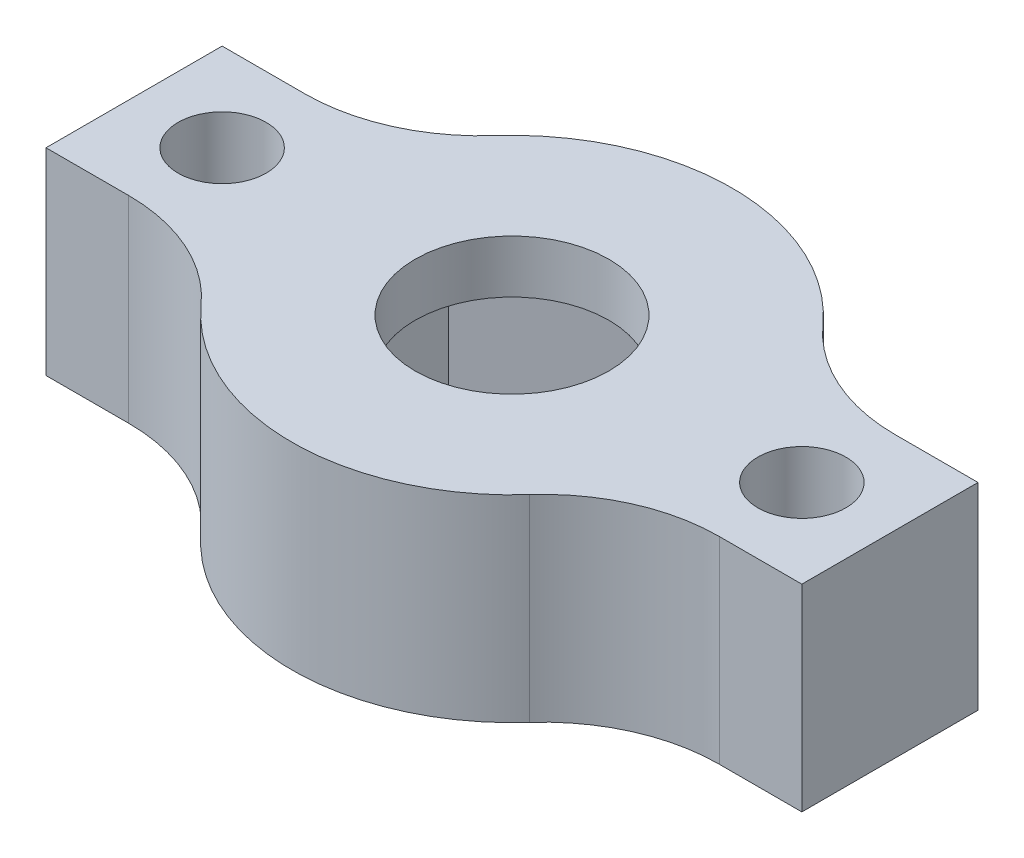
from build123d import *

# Parameters (mm, degrees)
SKETCH_1_R          = 12.5
EXTRUDE_1_DEPTH     = 8.2
SKETCH_2_R          = 12.5
EXTRUDE_2_DEPTH     = 3
SKETCH_3_W          = 10
SKETCH_3_H          = 10
EXTRUDE_3_DEPTH     = 11.2
FILLET_1_R          = 10
SKETCH_4_R          = 2.5
CUT_EXTRUDE_4_DEPTH = 28.240939498
SKETCH_5_R          = 5.5
CUT_EXTRUDE_5_DEPTH = 4


with BuildPart() as part:
    # Эскиз1 → Вытянуть1 (new body)
    with BuildSketch(Plane(origin=(0, 0, 0), x_dir=(1, 0, 0), z_dir=(0, 1, 0))):
        with Locations(Location((0, 0, 0), (0, 0, 270))):
            Circle(SKETCH_1_R)
        Polygon((8.5, -4.907477288), (8.5, 4.907477288), (0, 9.814954576), (-8.5, 4.907477288), (-8.5, -4.907477288), (0, -9.814954576), align=None, mode=Mode.SUBTRACT)
    extrude(amount=EXTRUDE_1_DEPTH)

    # Эскиз2 → Вытянуть2 (add)
    with BuildSketch(Plane(origin=(0, 8.2, 0), x_dir=(1, 0, 0), z_dir=(0, 1, 0))):
        with Locations(Location((0, 0, 0), (0, 0, 270))):
            Circle(SKETCH_2_R)
    extrude(amount=EXTRUDE_2_DEPTH)

    # Эскиз3 → Вытянуть3 (add)
    with BuildSketch(Plane.XZ):
        with Locations((16.456439237, 0)):
            Rectangle(SKETCH_3_W, SKETCH_3_H)
        with Locations((-16.456439237, 0)):
            Rectangle(SKETCH_3_W, SKETCH_3_H)
    extrude(amount=-EXTRUDE_3_DEPTH)

    # Скругление1
    fillet_1_edges = [part.edges().sort_by_distance(p)[0] for p in [
        (11.456439237, 5.6, 5),
        (11.456439237, 5.6, -5),
        (-11.456439237, 5.6, -5),
        (-11.456439237, 5.6, 5),
    ]]
    fillet(fillet_1_edges, radius=FILLET_1_R)

    # Эскиз4 → Вытянуть4 (cut, through all)
    with BuildSketch(Plane(origin=(0, 11.2, 0), x_dir=(1, 0, 0), z_dir=(0, 1, 0))):
        with Locations(Location((16.456439237, 0, 0), (0, 0, 270))):
            Circle(SKETCH_4_R)
        with Locations(Location((-16.456439237, 0, 0), (0, 0, 270))):
            Circle(SKETCH_4_R)
    extrude(amount=-CUT_EXTRUDE_4_DEPTH, mode=Mode.SUBTRACT)

    # Эскиз5 → Вытянуть5 (cut)
    with BuildSketch(Plane(origin=(0, 11.2, 0), x_dir=(1, 0, 0), z_dir=(0, 1, 0))):
        with Locations(Location((0, 0, 0), (0, 0, 270))):
            Circle(SKETCH_5_R)
    extrude(amount=-CUT_EXTRUDE_5_DEPTH, mode=Mode.SUBTRACT)


solid = part.part
